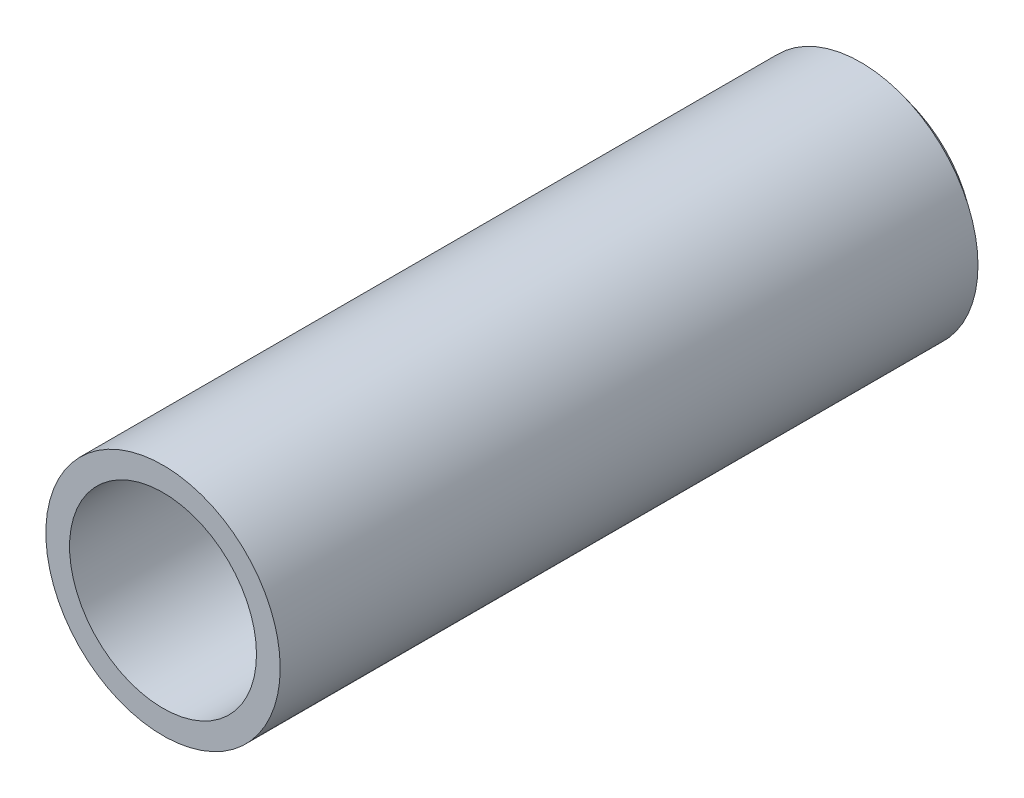
from build123d import *

# Parameters (mm, degrees)
SKETCH1_R      = 16.7005
SKETCH1_R_2    = 13.3223
EXTRUDE1_DEPTH = 50.8
CHAMFER2_SIZE  = 2.794
CHAMFER2_SIZE2 = 2.143911604


with BuildPart() as part:
    # Sketch1 → Extrude1 (new, symmetric)
    with BuildSketch(Plane.XY):
        Circle(SKETCH1_R)
        Circle(SKETCH1_R_2, mode=Mode.SUBTRACT)
    extrude(amount=EXTRUDE1_DEPTH, both=True)

    # Chamfer2
    chamfer2_edges = [part.edges().sort_by_distance(p)[0] for p in [
        (-16.7005, 0, -50.8),
    ]]
    chamfer2_side = [part.faces().sort_by_distance(p)[0] for p in [
        (-16.228138528, 0, -50.8),
    ]]
    chamfer(chamfer2_edges, length=CHAMFER2_SIZE, length2=CHAMFER2_SIZE2, reference=chamfer2_side[0])


solid = part.part
